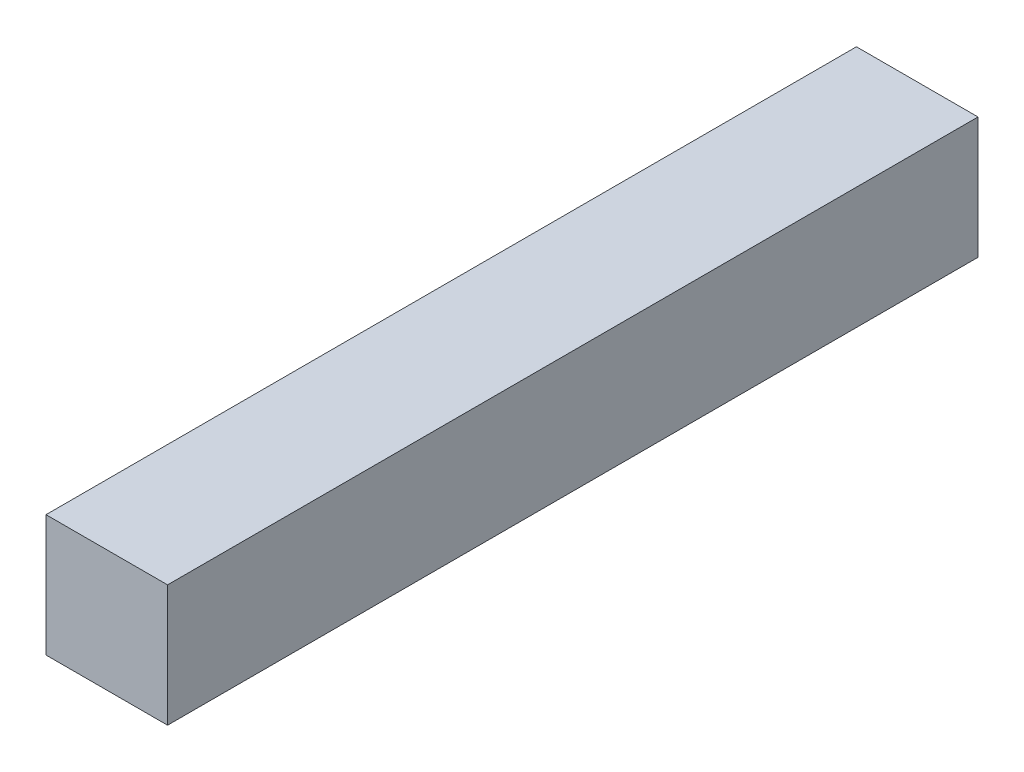
from build123d import *

# Parameters (mm, degrees)
SKETCH1_W           = 4.7625
SKETCH1_H           = 4.7625
BOSS_EXTRUDE1_DEPTH = 31.75


with BuildPart() as part:
    # Sketch1 → Boss-Extrude1 (new body)
    with BuildSketch(Plane.XY):
        Rectangle(SKETCH1_W, SKETCH1_H)
    extrude(amount=BOSS_EXTRUDE1_DEPTH)


solid = part.part
